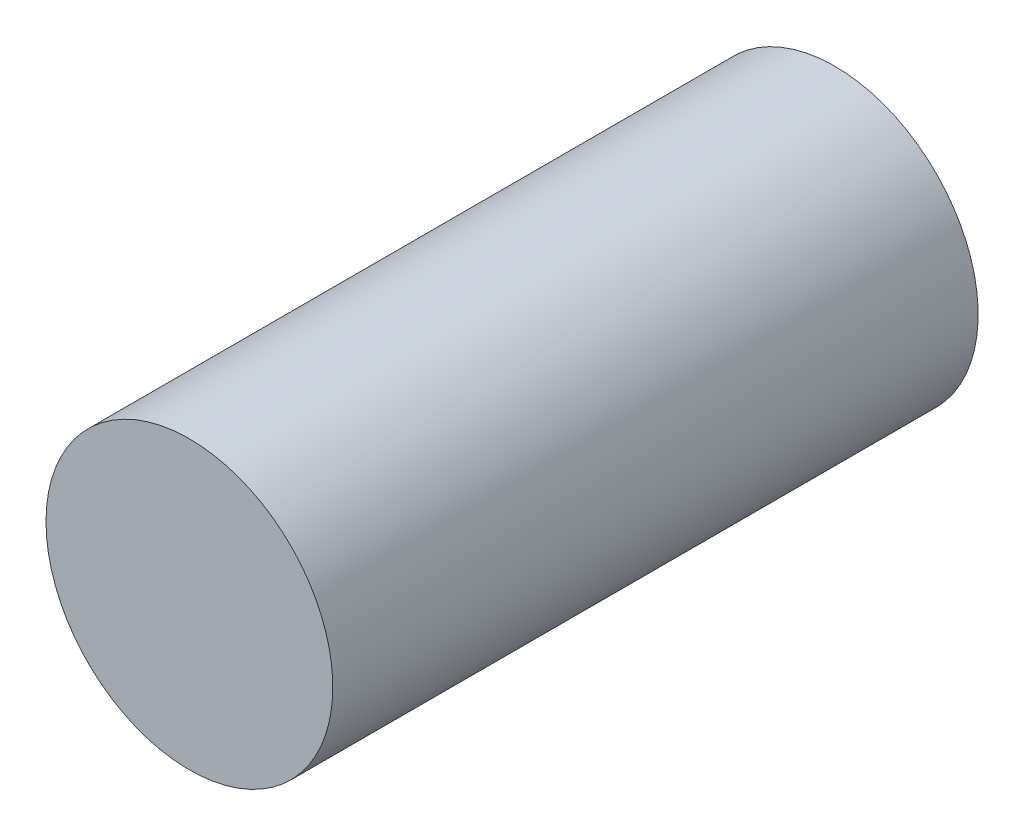
from build123d import *

# Parameters (mm, degrees)
SKETCH1_R           = 10
BOSS_EXTRUDE1_DEPTH = 45


with BuildPart() as part:
    # Sketch1 → Boss-Extrude1 (new body)
    with BuildSketch(Plane.XY):
        with Locations(Location((0, 0, 0), (0, 0, 180))):
            Circle(SKETCH1_R)
    extrude(amount=BOSS_EXTRUDE1_DEPTH)


solid = part.part
